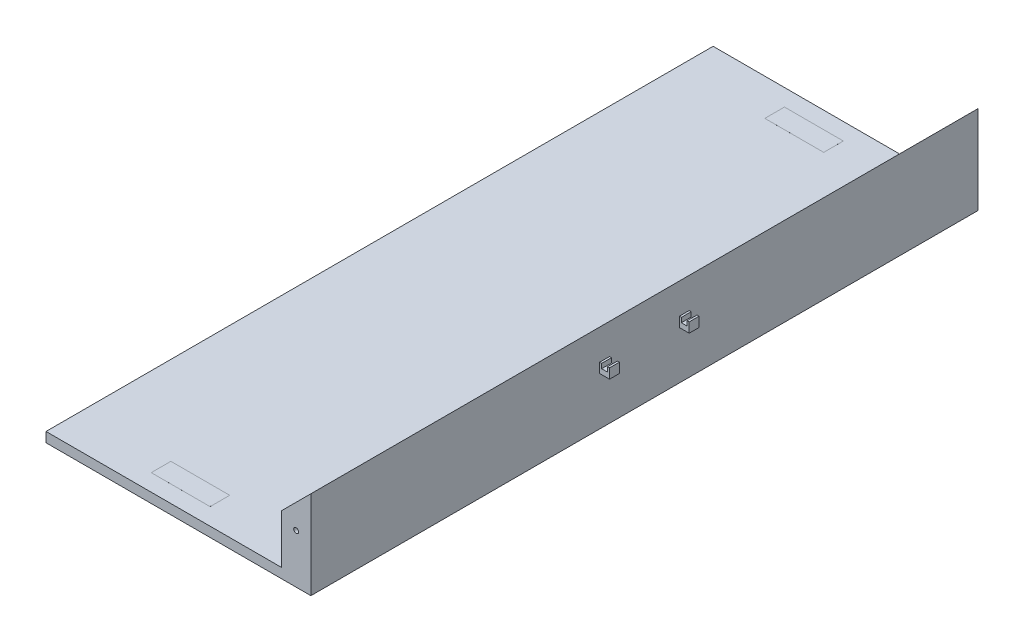
from build123d import *

# Parameters (mm, degrees)
BOSS_EXTRUDE1_DEPTH = 863.6
SKETCH3_R           = 3.175
CUT_EXTRUDE1_DEPTH  = 863.6
SKETCH2_W           = 304.8
SKETCH2_H           = 12.7
BOSS_EXTRUDE5_DEPTH = 863.6
SKETCH5_W           = 76.2
SKETCH5_H           = 25.4
BOSS_EXTRUDE6_DEPTH = 0.0127
SKETCH6_W           = 12.7
SKETCH6_H           = 12.7
BOSS_EXTRUDE8_DEPTH = 12.7
CUT_EXTRUDE2_DEPTH  = 137.668


with BuildPart() as part:
    # Sketch1 → Boss-Extrude1 (new body)
    with BuildSketch(Plane.XY):
        Polygon((0, 0), (38.1, 0), (38.1, 114.3), (19.716081556, 95.916081556), (0, 76.2), align=None)
    extrude(amount=BOSS_EXTRUDE1_DEPTH)

    # Sketch3 → Cut-Extrude1 (cut)
    with BuildSketch(Plane.XY.offset(863.6)):
        with Locations((19.05, 63.5)):
            Circle(SKETCH3_R)
    extrude(amount=-CUT_EXTRUDE1_DEPTH, mode=Mode.SUBTRACT)

    # Sketch2 → Boss-Extrude5 (add)
    with BuildSketch(Plane(origin=(0, 0, 0), x_dir=(-1, 0, 0), z_dir=(0, 0, -1))):
        with Locations((152.4, 6.35)):
            Rectangle(SKETCH2_W, SKETCH2_H)
    extrude(amount=-BOSS_EXTRUDE5_DEPTH)

    # Sketch5 → Boss-Extrude6 (add)
    with BuildSketch(Plane(origin=(0, 12.7, 0), x_dir=(1, 0, 0), z_dir=(0, 1, 0))):
        with Locations((-152.4, -34.636758867)):
            Rectangle(SKETCH5_W, SKETCH5_H)
        with Locations((-152.4, -828.963241133)):
            Rectangle(SKETCH5_W, SKETCH5_H)
    extrude(amount=BOSS_EXTRUDE6_DEPTH)

    # Sketch6 → Boss-Extrude8 (add)
    with BuildSketch(Plane(origin=(38.1, 0, 0), x_dir=(0, 0, -1), z_dir=(1, 0, 0))):
        with Locations((-380.236111085, 68.484263382)):
            Rectangle(SKETCH6_W, SKETCH6_H)
        with Locations((-483.363888915, 68.484263382)):
            Rectangle(SKETCH6_W, SKETCH6_H)
    extrude(amount=BOSS_EXTRUDE8_DEPTH)

    # Sketch7 → Cut-Extrude2 (cut)
    with BuildSketch(Plane.XY.offset(489.713888915)):
        Polygon((44.45, 68.812070036), (48.222471195, 68.812070036), (48.222471195, 74.834263382), (40.668527222, 74.834263382), (40.668527222, 68.812070036), align=None)
    extrude(amount=-CUT_EXTRUDE2_DEPTH, mode=Mode.SUBTRACT)


solid = part.part
